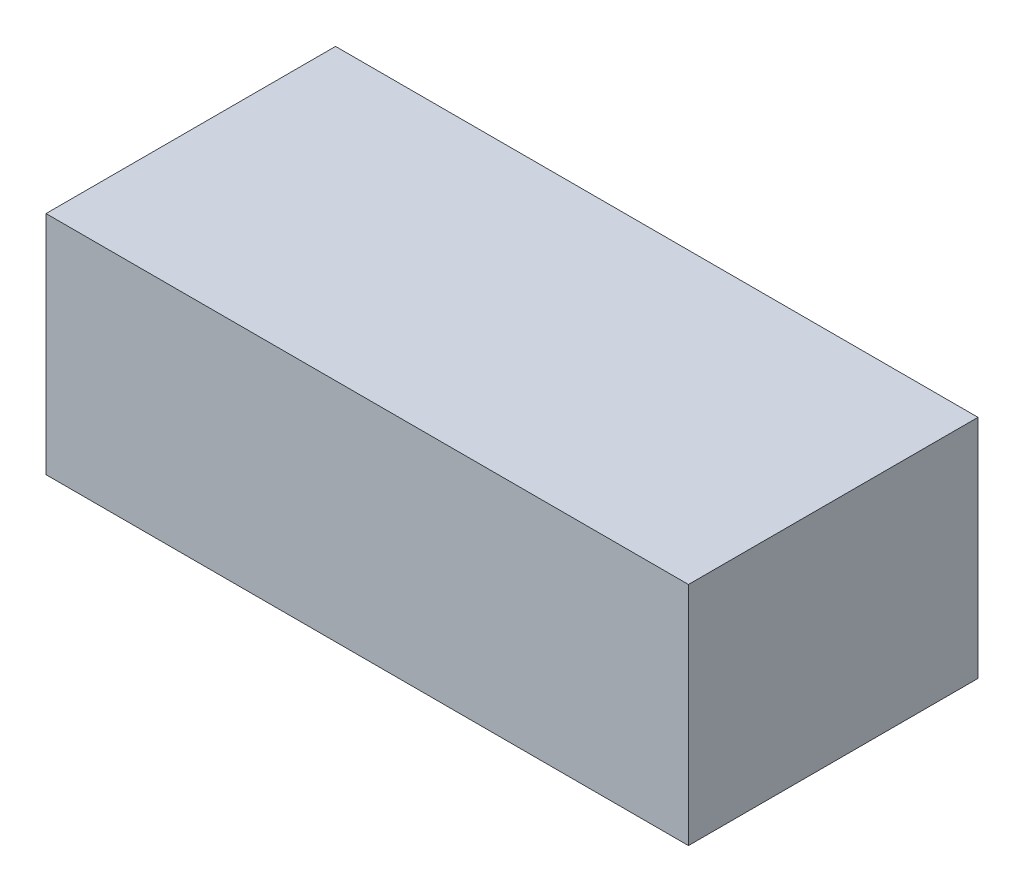
from build123d import *

# Parameters (mm, degrees)
SKETCH1_W           = 33.8
SKETCH1_H           = 26.4
BOSS_EXTRUDE1_DEPTH = 75


with BuildPart() as part:
    # Sketch1 → Boss-Extrude1 (new body)
    with BuildSketch(Plane(origin=(0, 0, 0), x_dir=(0, 0, -1), z_dir=(1, 0, 0))):
        Rectangle(SKETCH1_W, SKETCH1_H)
    extrude(amount=BOSS_EXTRUDE1_DEPTH)


solid = part.part
